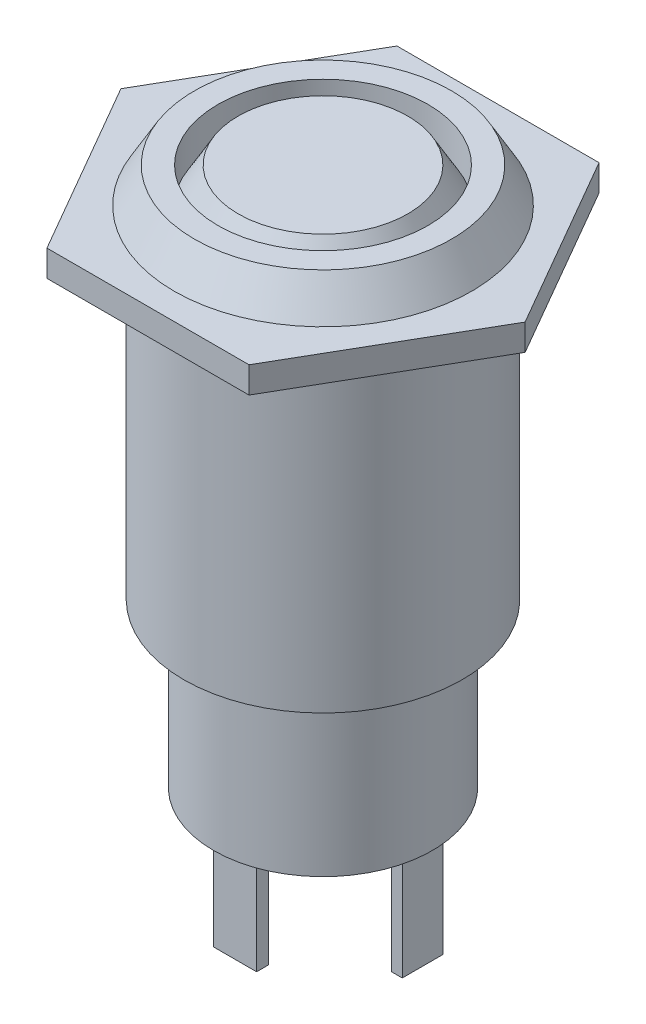
from build123d import *

# Parameters (mm, degrees)
SKETCH1_R           = 7.95
BOSS_EXTRUDE1_DEPTH = 19.5
BOSS_EXTRUDE2_DEPTH = 1.5
SKETCH3_R           = 8.5
BOSS_EXTRUDE3_DEPTH = 2
BOSS_EXTRUDE3_TAPER = 30
SKETCH4_R           = 6
CUT_EXTRUDE1_DEPTH  = 2
SKETCH6_R           = 6
BOSS_EXTRUDE4_DEPTH = 2
BOSS_EXTRUDE4_TAPER = 30
SKETCH7_R           = 6.25
BOSS_EXTRUDE5_DEPTH = 9.3
SKETCH8_W           = 2.45599171
SKETCH8_H           = 0.676111723
SKETCH8_W_2         = 0.61301599
SKETCH8_H_2         = 2.333871056
SKETCH8_H_3         = 0.814342288
SKETCH8_W_3         = 0.602821575
BOSS_EXTRUDE6_DEPTH = 6


with BuildPart() as part:
    # Sketch1 → Boss-Extrude1 (new body)
    with BuildSketch(Plane(origin=(0, 0, 0), x_dir=(1, 0, 0), z_dir=(0, 1, 0))):
        with Locations(Location((0, 0, 0), (0, 0, 270))):
            Circle(SKETCH1_R)
    extrude(amount=BOSS_EXTRUDE1_DEPTH)

    # Sketch2 → Boss-Extrude2 (add)
    with BuildSketch(Plane(origin=(0, 19.5, 0), x_dir=(1, 0, 0), z_dir=(0, 1, 0))):
        Polygon((11.547005384, 0), (5.773502692, 10), (-5.773502692, 10), (-11.547005384, 0), (-5.773502692, -10), (5.773502692, -10), align=None)
    extrude(amount=-BOSS_EXTRUDE2_DEPTH)

    # Sketch3 → Boss-Extrude3 (add)
    with BuildSketch(Plane(origin=(0, 19.5, 0), x_dir=(1, 0, 0), z_dir=(0, 1, 0))):
        Circle(SKETCH3_R)
    extrude(amount=BOSS_EXTRUDE3_DEPTH, taper=BOSS_EXTRUDE3_TAPER)

    # Sketch4 → Cut-Extrude1 (cut)
    with BuildSketch(Plane(origin=(0, 21.5, 0), x_dir=(1, 0, 0), z_dir=(0, 1, 0))):
        with Locations(Location((0, 0, 0), (0, 0, 270))):
            Circle(SKETCH4_R)
    extrude(amount=-CUT_EXTRUDE1_DEPTH, mode=Mode.SUBTRACT)

    # Sketch6 → Boss-Extrude4 (add)
    with BuildSketch(Plane(origin=(0, 19.5, 0), x_dir=(1, 0, 0), z_dir=(0, 1, 0))):
        with Locations(Location((0, 0, 0), (0, 0, 270))):
            Circle(SKETCH6_R)
    extrude(amount=BOSS_EXTRUDE4_DEPTH, taper=BOSS_EXTRUDE4_TAPER)

    # Sketch7 → Boss-Extrude5 (add)
    with BuildSketch(Plane.XZ):
        with Locations(Location((0, 0, 0), (0, 0, 90))):
            Circle(SKETCH7_R)
    extrude(amount=BOSS_EXTRUDE5_DEPTH)

    # Sketch8 → Boss-Extrude6 (add)
    with BuildSketch(Plane.XZ.offset(9.3)):
        with Locations((0, 4.683948284)):
            Rectangle(SKETCH8_W, SKETCH8_H)
        with Locations((5.389572467, 0)):
            Rectangle(SKETCH8_W_2, SKETCH8_H_2)
        with Locations((0, -4.982726266)):
            Rectangle(SKETCH8_W, SKETCH8_H_3)
        with Locations((-4.707688923, 0)):
            Rectangle(SKETCH8_W_3, SKETCH8_H_2)
    extrude(amount=BOSS_EXTRUDE6_DEPTH)


solid = part.part
